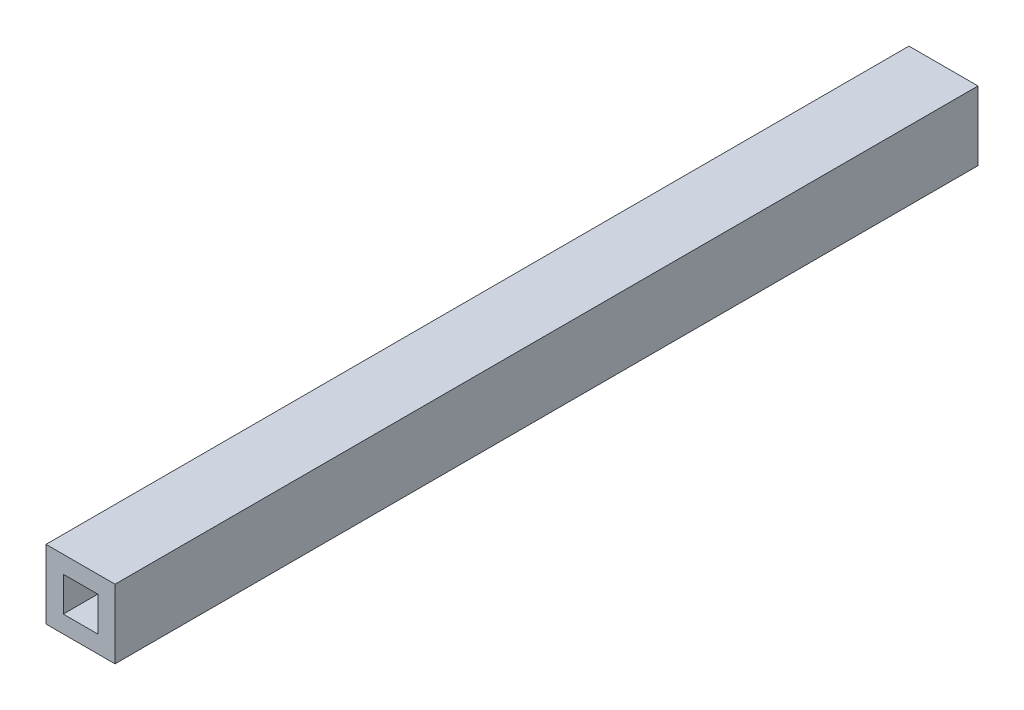
from build123d import *

# Parameters (mm, degrees)
SKETCH1_W           = 20
SKETCH1_H           = 20
SKETCH1_W_2         = 10
SKETCH1_H_2         = 10
EXTRUDE_THIN1_DEPTH = 250


with BuildPart() as part:
    # Sketch1 → Extrude-Thin1 (new body)
    with BuildSketch(Plane.XY):
        Rectangle(SKETCH1_W, SKETCH1_H)
        Rectangle(SKETCH1_W_2, SKETCH1_H_2, mode=Mode.SUBTRACT)
    extrude(amount=EXTRUDE_THIN1_DEPTH)


solid = part.part
